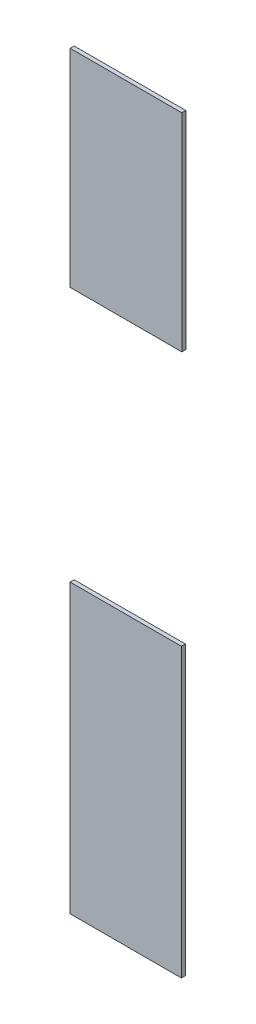
from build123d import *

# Parameters (mm, degrees)
SKETCH_3_W        = 350
SKETCH_3_H        = 649.25
EXTRUDE_1_DEPTH   = 12.5
SKETCH_3_W_2      = 348.5
SKETCH_3_H_2      = 900.75
EXTRUDE_1_2_DEPTH = 12.5


with BuildPart() as part:
    # Эскиз3 → Бобышка-Вытянуть1 (new body)
    with BuildSketch(Plane.XY):
        with Locations((-175, -324.625)):
            Rectangle(SKETCH_3_W, SKETCH_3_H)
    extrude(amount=EXTRUDE_1_DEPTH)


with BuildPart() as body_2:
    # Эскиз3 → Extrude 1 2 (new body)
    with BuildSketch(Plane.XY):
        with Locations((-175.75, -1899.625)):
            Rectangle(SKETCH_3_W_2, SKETCH_3_H_2)
    extrude(amount=EXTRUDE_1_2_DEPTH)


solid = Compound([part.part, body_2.part])
